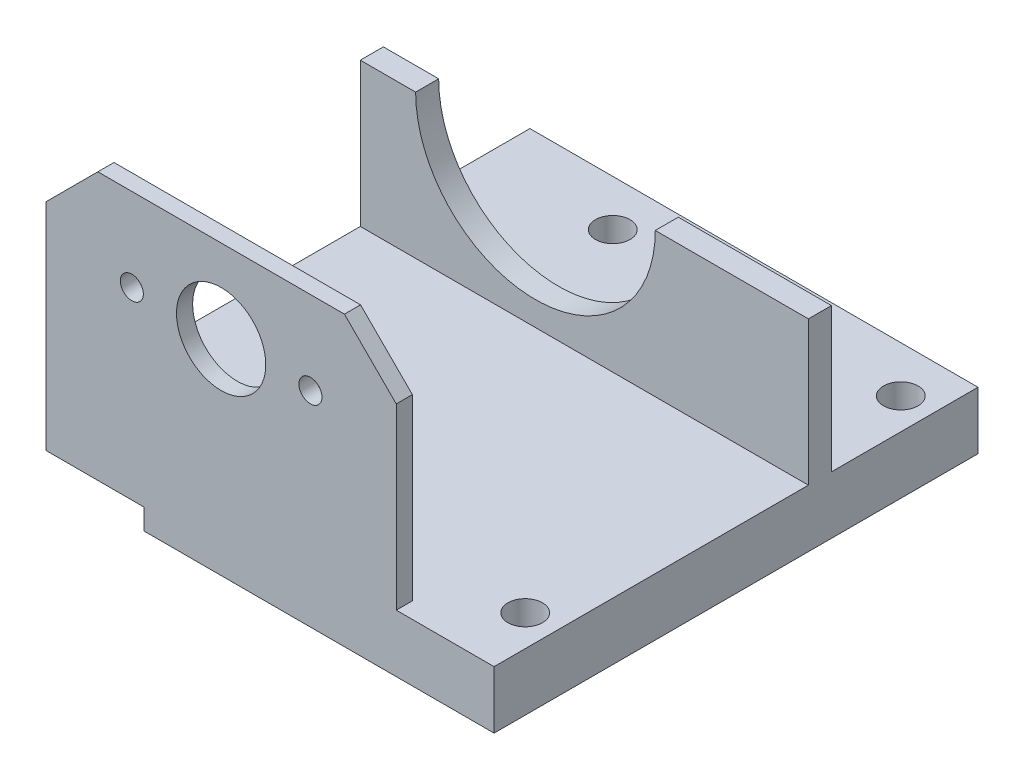
from build123d import *

# Parameters (mm, degrees)
SKETCH1_W           = 30.4
SKETCH1_H           = 42
BOSS_EXTRUDE1_DEPTH = 5
SKETCH2_W           = 42
SKETCH2_H           = 3.2
BOSS_EXTRUDE2_DEPTH = 8.49
SKETCH4_W           = 30.4
SKETCH4_H           = 1.4
BOSS_EXTRUDE3_DEPTH = 20
SKETCH5_R           = 3.875
SKETCH5_R_2         = 1
CUT_EXTRUDE1_DEPTH  = 1.4
CHAMFER1_SIZE       = 4.5
SKETCH6_R           = 1.5
CUT_EXTRUDE2_DEPTH  = 5
SKETCH7_W           = 38.89
SKETCH7_H           = 2
BOSS_EXTRUDE4_DEPTH = 12.5
SKETCH8_R           = 10.4
CUT_EXTRUDE3_DEPTH  = 2


with BuildPart() as part:
    # Sketch1 → Boss-Extrude1 (new body)
    with BuildSketch(Plane(origin=(0, 0, 0), x_dir=(1, 0, 0), z_dir=(0, 1, 0))):
        Rectangle(SKETCH1_W, SKETCH1_H)
    extrude(amount=BOSS_EXTRUDE1_DEPTH)

    # Sketch2 → Boss-Extrude2 (add)
    with BuildSketch(Plane.ZY.offset(15.2)):
        with Locations((0, 3.4)):
            Rectangle(SKETCH2_W, SKETCH2_H)
    extrude(amount=BOSS_EXTRUDE2_DEPTH)

    # Sketch4 → Boss-Extrude3 (add)
    with BuildSketch(Plane(origin=(0, 5, 0), x_dir=(1, 0, 0), z_dir=(0, 1, 0))):
        with Locations((-8.49, -20.3)):
            Rectangle(SKETCH4_W, SKETCH4_H)
    extrude(amount=BOSS_EXTRUDE3_DEPTH)

    # Sketch5 → Cut-Extrude1 (cut)
    with BuildSketch(Plane(origin=(0, 0, 19.6), x_dir=(-1, 0, 0), z_dir=(0, 0, -1))):
        with Locations((8.49, 17.78)):
            Circle(SKETCH5_R)
        with Locations((0.74, 17.78)):
            Circle(SKETCH5_R_2)
        with Locations((16.24, 17.78)):
            Circle(SKETCH5_R_2)
    extrude(amount=-CUT_EXTRUDE1_DEPTH, mode=Mode.SUBTRACT)

    # Chamfer1
    chamfer1_edges = [part.edges().sort_by_distance(p)[0] for p in [
        (-23.69, 25, 20.3),
        (6.71, 25, 20.3),
    ]]
    chamfer(chamfer1_edges, length=CHAMFER1_SIZE)

    # Sketch6 → Cut-Extrude2 (cut)
    with BuildSketch(Plane(origin=(0, 5, 0), x_dir=(1, 0, 0), z_dir=(0, 1, 0))):
        with Locations(Location((12.5, -15.6, 0), (0, 0, 270))):
            Circle(SKETCH6_R)
        with Locations(Location((12.5, 17, 0), (0, 0, 270))):
            Circle(SKETCH6_R)
        with Locations(Location((-12.5, 17, 0), (0, 0, 270))):
            Circle(SKETCH6_R)
        with Locations(Location((-12.5, -15.6, 0), (0, 0, 270))):
            Circle(SKETCH6_R)
    extrude(amount=-CUT_EXTRUDE2_DEPTH, mode=Mode.SUBTRACT)

    # Sketch7 → Boss-Extrude4 (add)
    with BuildSketch(Plane(origin=(0, 5, 0), x_dir=(1, 0, 0), z_dir=(0, 1, 0))):
        with Locations((-4.245, 7.28)):
            Rectangle(SKETCH7_W, SKETCH7_H)
    extrude(amount=BOSS_EXTRUDE4_DEPTH)

    # Sketch8 → Cut-Extrude3 (cut)
    with BuildSketch(Plane(origin=(0, 0, -8.28), x_dir=(-1, 0, 0), z_dir=(0, 0, -1))):
        with Locations((8.49, 17.5)):
            Circle(SKETCH8_R)
    extrude(amount=-CUT_EXTRUDE3_DEPTH, mode=Mode.SUBTRACT)


solid = part.part
